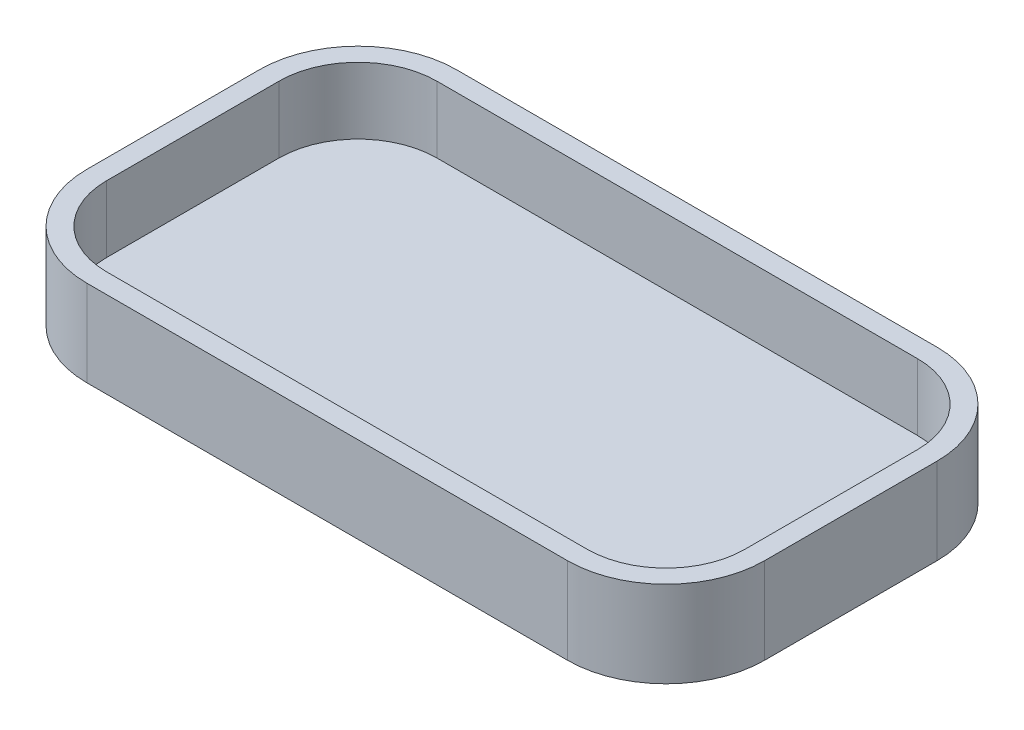
from build123d import *

# Parameters (mm, degrees)
SKETCH1_W           = 55
SKETCH1_H           = 30
BOSS_EXTRUDE1_DEPTH = 7
FILLET1_R           = 8
SHELL1_T            = -1.6


with BuildPart() as part:
    # Sketch1 → Boss-Extrude1 (new body)
    with BuildSketch(Plane(origin=(0, 0, 0), x_dir=(1, 0, 0), z_dir=(0, 1, 0))):
        Rectangle(SKETCH1_W, SKETCH1_H)
    extrude(amount=BOSS_EXTRUDE1_DEPTH)

    # Fillet1
    fillet1_edges = [part.edges().sort_by_distance(p)[0] for p in [
        (27.5, 3.5, 15),
        (-27.5, 3.5, 15),
        (-27.5, 3.5, -15),
        (27.5, 3.5, -15),
    ]]
    fillet(fillet1_edges, radius=FILLET1_R)

    # Shell1
    shell1_openings = [part.faces().sort_by_distance(p)[0] for p in [
        (0, 7, 0),
    ]]
    offset(amount=SHELL1_T, openings=shell1_openings, kind=Kind.INTERSECTION)


solid = part.part
